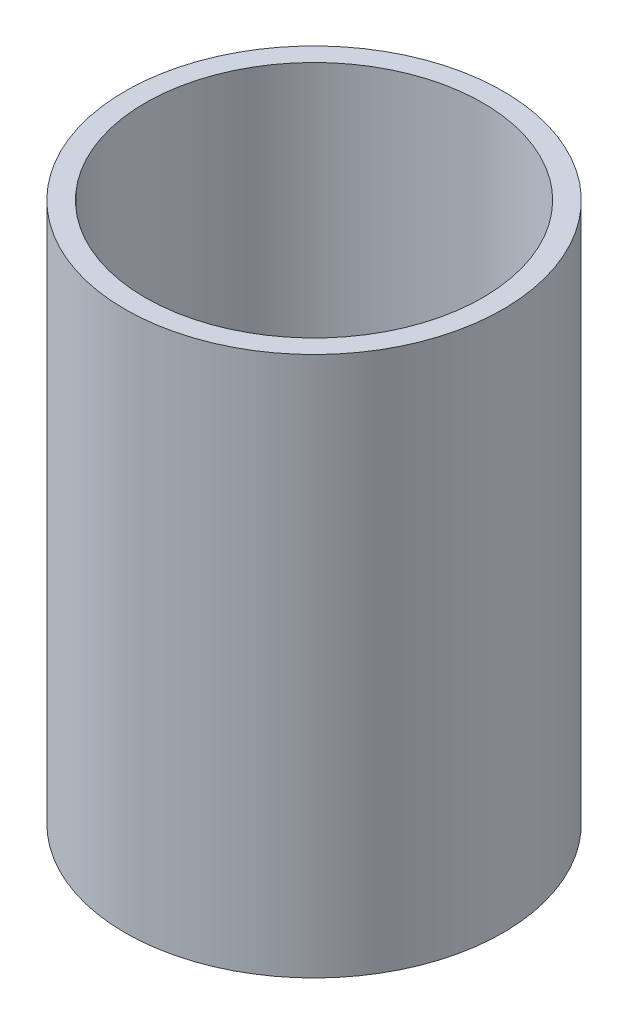
from build123d import *

# Parameters (mm, degrees)
SKETCH_1_R      = 140
SKETCH_1_R_2    = 125
EXTRUDE_1_DEPTH = 400


with BuildPart() as part:
    # 草图1 → 凸台-拉伸1 (new body)
    with BuildSketch(Plane(origin=(0, 0, 0), x_dir=(1, 0, 0), z_dir=(0, 1, 0))):
        with Locations(Location((0, 0, 0), (0, 0, 270))):
            Circle(SKETCH_1_R)
        with Locations(Location((0, 0, 0), (0, 0, 270))):
            Circle(SKETCH_1_R_2, mode=Mode.SUBTRACT)
    extrude(amount=EXTRUDE_1_DEPTH)


solid = part.part
